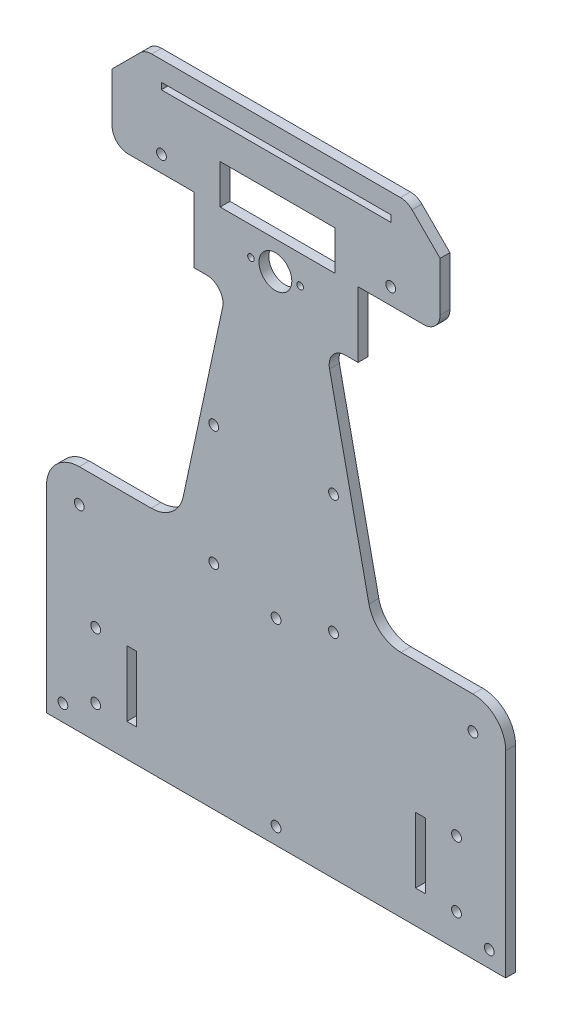
from build123d import *

# Parameters (mm, degrees)
SALIENTE_EXTRUIR1_DEPTH = 3
REDONDEO1_R             = 5
REDONDEO2_R             = 10
CROQUIS2_R              = 1.5
CROQUIS2_R_2            = 5
CROQUIS2_R_3            = 1
CROQUIS2_W              = 35
CROQUIS2_H              = 12
CROQUIS2_W_2            = 70
CROQUIS2_H_2            = 2
CROQUIS2_W_3            = 3
CROQUIS2_H_3            = 20
CORTAR_EXTRUIR1_DEPTH   = 10
CHAFL_N1_SIZE           = 10
REDONDEO3_R             = 5


with BuildPart() as part:
    # Croquis1 → Saliente-Extruir1 (new body)
    with BuildSketch(Plane.XY):
        Polygon((70, 0), (-70, 0), (-70, 70), (-30, 70), (-15, 140), (-25, 140), (-25, 160), (-50, 160), (-50, 190), (50, 190), (50, 160), (25, 160), (25, 140), (15, 140), (30, 70), (70, 70), align=None)
    extrude(amount=SALIENTE_EXTRUIR1_DEPTH)

    # Redondeo1
    redondeo1_edges = [part.edges().sort_by_distance(p)[0] for p in [
        (-15, 140, 1.5),
        (-50, 160, 1.5),
        (50, 160, 1.5),
        (15, 140, 1.5),
    ]]
    fillet(redondeo1_edges, radius=REDONDEO1_R)

    # Redondeo2
    redondeo2_edges = [part.edges().sort_by_distance(p)[0] for p in [
        (-70, 70, 1.5),
        (-30, 70, 1.5),
        (30, 70, 1.5),
        (70, 70, 1.5),
    ]]
    fillet(redondeo2_edges, radius=REDONDEO2_R)

    # Croquis2 → Cortar-Extruir1 (cut)
    with BuildSketch(Plane.XY.offset(3)):
        with Locations((-55, 10)):
            Circle(CROQUIS2_R)
        with Locations((-55, 30)):
            Circle(CROQUIS2_R)
        with Locations((55, 10)):
            Circle(CROQUIS2_R)
        with Locations((55, 30)):
            Circle(CROQUIS2_R)
        with Locations((34.95, 165)):
            Circle(CROQUIS2_R)
        with Locations((-0.20543979, 151.386853188)):
            Circle(CROQUIS2_R_2)
        with Locations((-7.65543979, 151.386853188)):
            Circle(CROQUIS2_R_3)
        with Locations((7.34456021, 151.386853188)):
            Circle(CROQUIS2_R_3)
        with Locations((-65, 5)):
            Circle(CROQUIS2_R)
        with Locations((-60, 60)):
            Circle(CROQUIS2_R)
        with Locations((65, 5)):
            Circle(CROQUIS2_R)
        with Locations((60, 60)):
            Circle(CROQUIS2_R)
        with Locations((0, 5)):
            Circle(CROQUIS2_R)
        with Locations((0, 60)):
            Circle(CROQUIS2_R)
        with Locations((-19, 65)):
            Circle(CROQUIS2_R)
        with Locations((17.5, 65)):
            Circle(CROQUIS2_R)
        with Locations((-19, 101.5)):
            Circle(CROQUIS2_R)
        with Locations((17.5, 101.5)):
            Circle(CROQUIS2_R)
        with Locations((-34.95, 165)):
            Circle(CROQUIS2_R)
        with Locations((0.45, 166.017006834)):
            Rectangle(CROQUIS2_W, CROQUIS2_H)
        with Locations((0, 183)):
            Rectangle(CROQUIS2_W_2, CROQUIS2_H_2)
        with Locations((-44, 20)):
            Rectangle(CROQUIS2_W_3, CROQUIS2_H_3)
        with Locations((44, 20)):
            Rectangle(CROQUIS2_W_3, CROQUIS2_H_3)
    extrude(amount=-CORTAR_EXTRUIR1_DEPTH, mode=Mode.SUBTRACT)

    # Chaflán1
    chafl_n1_edges = [part.edges().sort_by_distance(p)[0] for p in [
        (-50, 190, 1.5),
        (50, 190, 1.5),
    ]]
    chamfer(chafl_n1_edges, length=CHAFL_N1_SIZE)

    # Redondeo3
    redondeo3_edges = [part.edges().sort_by_distance(p)[0] for p in [
        (40, 190, 1.5),
        (-40, 190, 1.5),
    ]]
    fillet(redondeo3_edges, radius=REDONDEO3_R)


solid = part.part
